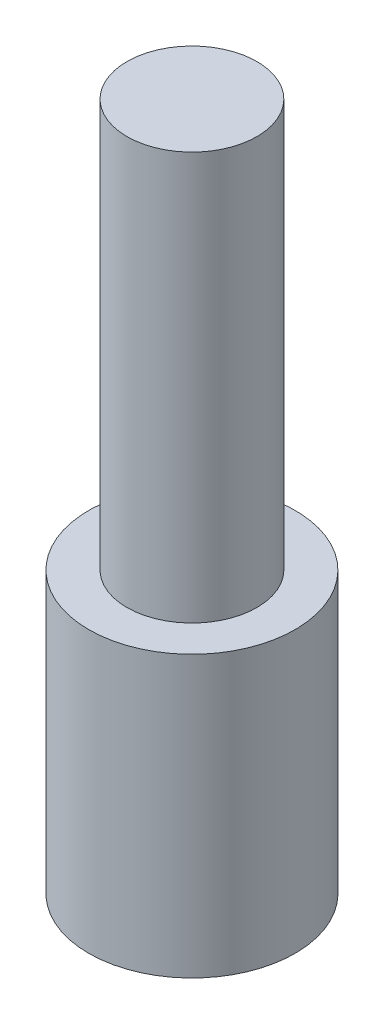
from build123d import *

# Parameters (mm, degrees)
SKETCH1_R           = 4.05
BOSS_EXTRUDE1_DEPTH = 11
SKETCH3_R           = 2.55
BOSS_EXTRUDE2_DEPTH = 16


with BuildPart() as part:
    # Sketch1 → Boss-Extrude1 (new body)
    with BuildSketch(Plane(origin=(0, 0, 0), x_dir=(1, 0, 0), z_dir=(0, 1, 0))):
        with Locations(Location((0, 0, 0), (0, 0, 270))):
            Circle(SKETCH1_R)
    extrude(amount=BOSS_EXTRUDE1_DEPTH)

    # Sketch3 → Boss-Extrude2 (add)
    with BuildSketch(Plane(origin=(0, 11, 0), x_dir=(1, 0, 0), z_dir=(0, 1, 0))):
        with Locations(Location((0, 0, 0), (0, 0, 270))):
            Circle(SKETCH3_R)
    extrude(amount=BOSS_EXTRUDE2_DEPTH)


solid = part.part
